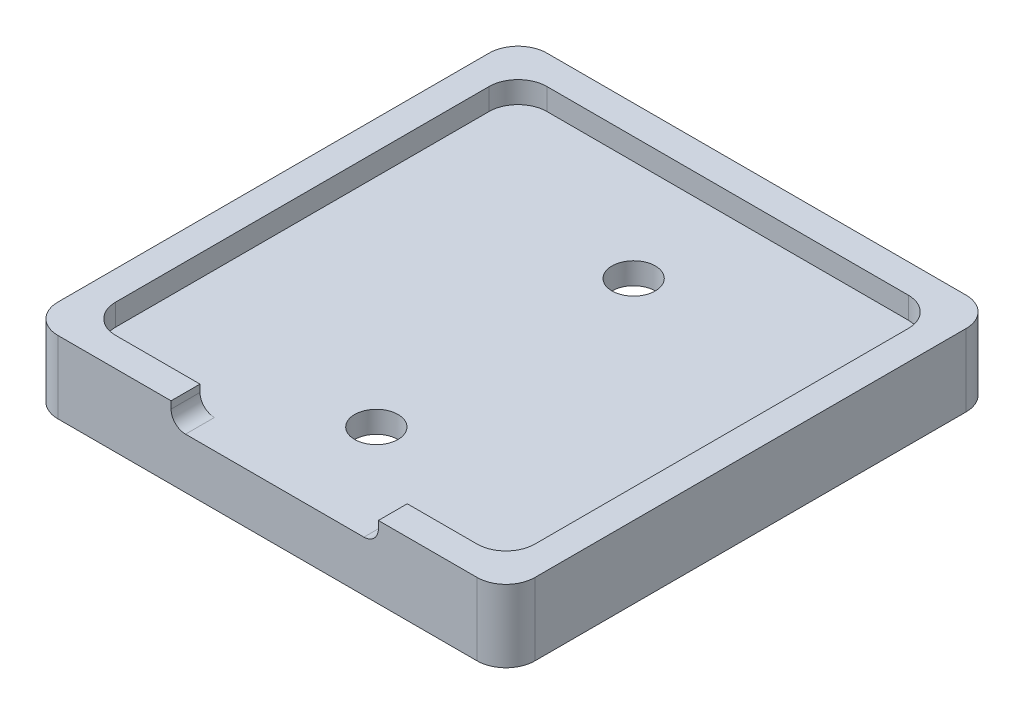
from build123d import *

# Parameters (mm, degrees)
SKETCH1_W           = 33
SKETCH1_H           = 33.83
BOSS_EXTRUDE1_DEPTH = 5
SKETCH2_W           = 29
SKETCH2_H           = 29.83
CUT_EXTRUDE1_DEPTH  = 1.5
SKETCH3_R           = 1.5
CUT_EXTRUDE3_DEPTH  = 31
CUT_EXTRUDE4_DEPTH  = 2
FILLET1_R           = 2
SKETCH5_W           = 11.644842875
SKETCH5_H           = 2.596903013
CUT_EXTRUDE5_DEPTH  = 2
CUT_EXTRUDE9_DEPTH  = 10
FILLET5_R           = 1
FILLET6_R           = 1


with BuildPart() as part:
    # Sketch1 → Boss-Extrude1 (new body)
    with BuildSketch(Plane(origin=(0, 0, 0), x_dir=(1, 0, 0), z_dir=(0, 1, 0))):
        Rectangle(SKETCH1_W, SKETCH1_H)
    extrude(amount=-BOSS_EXTRUDE1_DEPTH)

    # Sketch2 → Cut-Extrude1 (cut)
    with BuildSketch(Plane(origin=(0, 0, 0), x_dir=(1, 0, 0), z_dir=(0, 1, 0))):
        Rectangle(SKETCH2_W, SKETCH2_H)
    extrude(amount=-CUT_EXTRUDE1_DEPTH, mode=Mode.SUBTRACT)

    # Sketch3 → Cut-Extrude3 (cut)
    with BuildSketch(Plane(origin=(0, 0, 0), x_dir=(1, 0, 0), z_dir=(0, 1, 0))):
        with Locations((0.5, 7.915)):
            Circle(SKETCH3_R)
        with Locations((0.5, -9.885)):
            Circle(SKETCH3_R)
    extrude(amount=-CUT_EXTRUDE3_DEPTH, mode=Mode.SUBTRACT)

    # Sketch4 → Cut-Extrude4 (cut)
    with BuildSketch(Plane.XZ.offset(5)):
        with BuildLine():
            Line((-4.5, 9.885), (-4.5, -7.915))
            ThreePointArc((-4.5, -7.915), (0.5, -12.915), (5.5, -7.915))
            Line((5.5, -7.915), (5.5, 9.885))
            ThreePointArc((5.5, 9.885), (0.5, 14.885), (-4.5, 9.885))
        make_face()
    extrude(amount=-CUT_EXTRUDE4_DEPTH, mode=Mode.SUBTRACT)

    # Fillet1
    fillet1_edges = [part.edges().sort_by_distance(p)[0] for p in [
        (14.5, -0.75, -14.915),
        (14.5, -0.75, 14.915),
        (-14.5, -0.75, 14.915),
        (-16.5, -2.5, 16.915),
        (-16.5, -2.5, -16.915),
        (-14.5, -0.75, -14.915),
        (16.5, -2.5, -16.915),
        (16.5, -2.5, 16.915),
    ]]
    fillet(fillet1_edges, radius=FILLET1_R)

    # Sketch5 → Cut-Extrude5 (cut)
    with BuildSketch(Plane.XZ.offset(5)):
        with Locations((0.473449804, 8.503582245)):
            Rectangle(SKETCH5_W, SKETCH5_H)
    extrude(amount=-CUT_EXTRUDE5_DEPTH, mode=Mode.SUBTRACT)

    # Sketch7 → Cut-Extrude9 (cut)
    with BuildSketch(Plane.XY.offset(16.915)):
        Polygon((0.5, 0), (-6.67, 0), (-6.67, -1.5), (7.67, -1.5), (7.67, 0), align=None)
    extrude(amount=-CUT_EXTRUDE9_DEPTH, mode=Mode.SUBTRACT)

    # Fillet5
    fillet5_edges = [part.edges().sort_by_distance(p)[0] for p in [
        (-6.67, -1.5, 15.915),
    ]]
    fillet(fillet5_edges, radius=FILLET5_R)

    # Fillet6
    fillet6_edges = [part.edges().sort_by_distance(p)[0] for p in [
        (7.67, -1.5, 15.915),
    ]]
    fillet(fillet6_edges, radius=FILLET6_R)


solid = part.part
